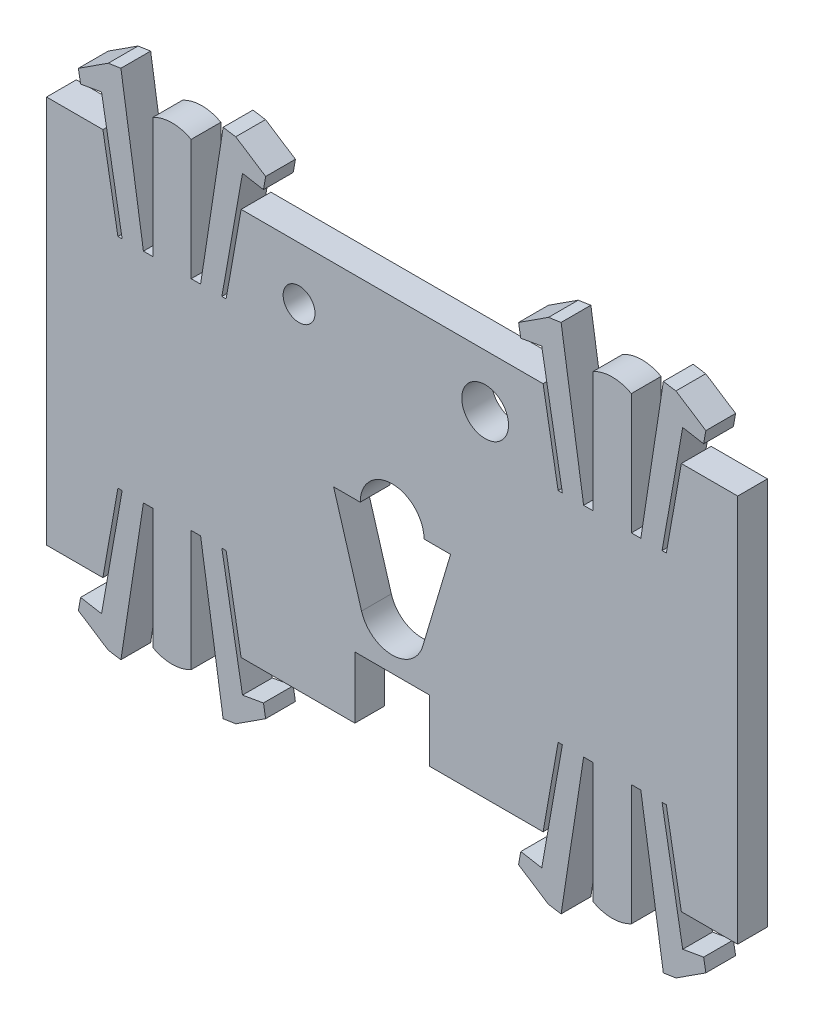
from build123d import *

# Parameters (mm, degrees)
MODEL_R                 = 1.5
MODEL_R_2               = 2.2
P_IDAT_VYSUNUT_M1_DEPTH = 2.8


with BuildPart() as part:
    # Model → Přidat vysunutím1 (new body)
    with BuildSketch(Plane.XY):
        with BuildLine():
            Line((-14.2, 18.25), (14.2, 18.25))
            Line((14.2, 18.25), (15.610615846, 10.25))
            Line((15.610615846, 10.25), (16.010615846, 10.25))
            Line((16.010615846, 10.25), (14.071019058, 21.25))
            Line((14.071019058, 21.25), (12.101403552, 20.902703645))
            Line((12.101403552, 20.902703645), (11.893025739, 22.084472948))
            Line((11.893025739, 22.084472948), (14.706771698, 23.907401431))
            Line((14.706771698, 23.907401431), (15.892964362, 24.088914415))
            Line((15.892964362, 24.088914415), (18.010615846, 10.25))
            Line((18.010615846, 10.25), (18.9, 10.25))
            Line((18.9, 10.25), (18.9, 21.596640106))
            ThreePointArc((18.9, 21.596640106), (20.7, 22.05), (22.5, 21.596640106))
            Line((22.5, 21.596640106), (22.5, 10.25))
            Line((22.5, 10.25), (23.389384154, 10.25))
            Line((23.389384154, 10.25), (25.507035638, 24.088914415))
            Line((25.507035638, 24.088914415), (26.693228302, 23.907401431))
            Line((26.693228302, 23.907401431), (29.506974261, 22.084472948))
            Line((29.506974261, 22.084472948), (29.298596448, 20.902703645))
            Line((29.298596448, 20.902703645), (27.328980942, 21.25))
            Line((27.328980942, 21.25), (25.389384154, 10.25))
            Line((25.389384154, 10.25), (25.789384154, 10.25))
            Line((25.789384154, 10.25), (27.2, 18.25))
            Line((27.2, 18.25), (32.5, 18.25))
            Line((32.5, 18.25), (32.5, -18.25))
            Line((32.5, -18.25), (27.2, -18.25))
            Line((27.2, -18.25), (25.789384154, -10.25))
            Line((25.789384154, -10.25), (25.389384154, -10.25))
            Line((25.389384154, -10.25), (27.328980942, -21.25))
            Line((27.328980942, -21.25), (29.298596448, -20.902703645))
            Line((29.298596448, -20.902703645), (29.506974261, -22.084472948))
            Line((29.506974261, -22.084472948), (26.693228302, -23.907401431))
            Line((26.693228302, -23.907401431), (25.507035638, -24.088914415))
            Line((25.507035638, -24.088914415), (23.389384154, -10.25))
            Line((23.389384154, -10.25), (22.5, -10.25))
            Line((22.5, -10.25), (22.5, -21.596640106))
            ThreePointArc((22.5, -21.596640106), (20.7, -22.05), (18.9, -21.596640106))
            Line((18.9, -21.596640106), (18.9, -10.25))
            Line((18.9, -10.25), (18.010615846, -10.25))
            Line((18.010615846, -10.25), (15.892964362, -24.088914415))
            Line((15.892964362, -24.088914415), (14.706771698, -23.907401431))
            Line((14.706771698, -23.907401431), (11.893025739, -22.084472948))
            Line((11.893025739, -22.084472948), (12.101403552, -20.902703645))
            Line((12.101403552, -20.902703645), (14.071019058, -21.25))
            Line((14.071019058, -21.25), (16.010615846, -10.25))
            Line((16.010615846, -10.25), (15.610615846, -10.25))
            Line((15.610615846, -10.25), (14.2, -18.25))
            Line((14.2, -18.25), (3.5, -18.25))
            Line((3.5, -18.25), (3.5, -12.45))
            Line((3.5, -12.45), (-3.5, -12.45))
            Line((-3.5, -12.45), (-3.5, -18.25))
            Line((-3.5, -18.25), (-14.2, -18.25))
            Line((-14.2, -18.25), (-15.610615846, -10.25))
            Line((-15.610615846, -10.25), (-16.010615846, -10.25))
            Line((-16.010615846, -10.25), (-14.071019058, -21.25))
            Line((-14.071019058, -21.25), (-12.101403552, -20.902703645))
            Line((-12.101403552, -20.902703645), (-11.893025739, -22.084472948))
            Line((-11.893025739, -22.084472948), (-14.706771698, -23.907401431))
            Line((-14.706771698, -23.907401431), (-15.892964362, -24.088914415))
            Line((-15.892964362, -24.088914415), (-18.010615846, -10.25))
            Line((-18.010615846, -10.25), (-18.9, -10.25))
            Line((-18.9, -10.25), (-18.9, -21.596640106))
            ThreePointArc((-18.9, -21.596640106), (-20.7, -22.05), (-22.5, -21.596640106))
            Line((-22.5, -21.596640106), (-22.5, -10.25))
            Line((-22.5, -10.25), (-23.389384154, -10.25))
            Line((-23.389384154, -10.25), (-25.507035638, -24.088914415))
            Line((-25.507035638, -24.088914415), (-26.693228302, -23.907401431))
            Line((-26.693228302, -23.907401431), (-29.506974261, -22.084472948))
            Line((-29.506974261, -22.084472948), (-29.298596448, -20.902703645))
            Line((-29.298596448, -20.902703645), (-27.328980942, -21.25))
            Line((-27.328980942, -21.25), (-25.389384154, -10.25))
            Line((-25.389384154, -10.25), (-25.789384154, -10.25))
            Line((-25.789384154, -10.25), (-27.2, -18.25))
            Line((-27.2, -18.25), (-32.5, -18.25))
            Line((-32.5, -18.25), (-32.5, 18.25))
            Line((-32.5, 18.25), (-27.2, 18.25))
            Line((-27.2, 18.25), (-25.789384154, 10.25))
            Line((-25.789384154, 10.25), (-25.389384154, 10.25))
            Line((-25.389384154, 10.25), (-27.328980942, 21.25))
            Line((-27.328980942, 21.25), (-29.298596448, 20.902703645))
            Line((-29.298596448, 20.902703645), (-29.506974261, 22.084472948))
            Line((-29.506974261, 22.084472948), (-26.693228302, 23.907401431))
            Line((-26.693228302, 23.907401431), (-25.507035638, 24.088914415))
            Line((-25.507035638, 24.088914415), (-23.389384154, 10.25))
            Line((-23.389384154, 10.25), (-22.5, 10.25))
            Line((-22.5, 10.25), (-22.5, 21.596640106))
            ThreePointArc((-22.5, 21.596640106), (-20.7, 22.05), (-18.9, 21.596640106))
            Line((-18.9, 21.596640106), (-18.9, 10.25))
            Line((-18.9, 10.25), (-18.010615846, 10.25))
            Line((-18.010615846, 10.25), (-15.892964362, 24.088914415))
            Line((-15.892964362, 24.088914415), (-14.706771698, 23.907401431))
            Line((-14.706771698, 23.907401431), (-11.893025739, 22.084472948))
            Line((-11.893025739, 22.084472948), (-12.101403552, 20.902703645))
            Line((-12.101403552, 20.902703645), (-14.071019058, 21.25))
            Line((-14.071019058, 21.25), (-16.010615846, 10.25))
            Line((-16.010615846, 10.25), (-15.610615846, 10.25))
            Line((-15.610615846, 10.25), (-14.2, 18.25))
        make_face()
        with Locations((-8.75, 13.25)):
            Circle(MODEL_R, mode=Mode.SUBTRACT)
        with Locations(Location((8.75, 13.25, 0), (0, 0, 180))):
            Circle(MODEL_R_2, mode=Mode.SUBTRACT)
        with BuildLine():
            Line((2.875009535, -8.806924836), (5.5, 0))
            Line((5.5, 0), (3, 0))
            ThreePointArc((3, 0), (0, 3), (-3, 0))
            Line((-3, 0), (-5.5, 0))
            Line((-5.5, 0), (-2.875009535, -8.806924836))
            ThreePointArc((-2.875009535, -8.806924836), (0, -10.95), (2.875009535, -8.806924836))
        make_face(mode=Mode.SUBTRACT)
    extrude(amount=P_IDAT_VYSUNUT_M1_DEPTH)


solid = part.part
